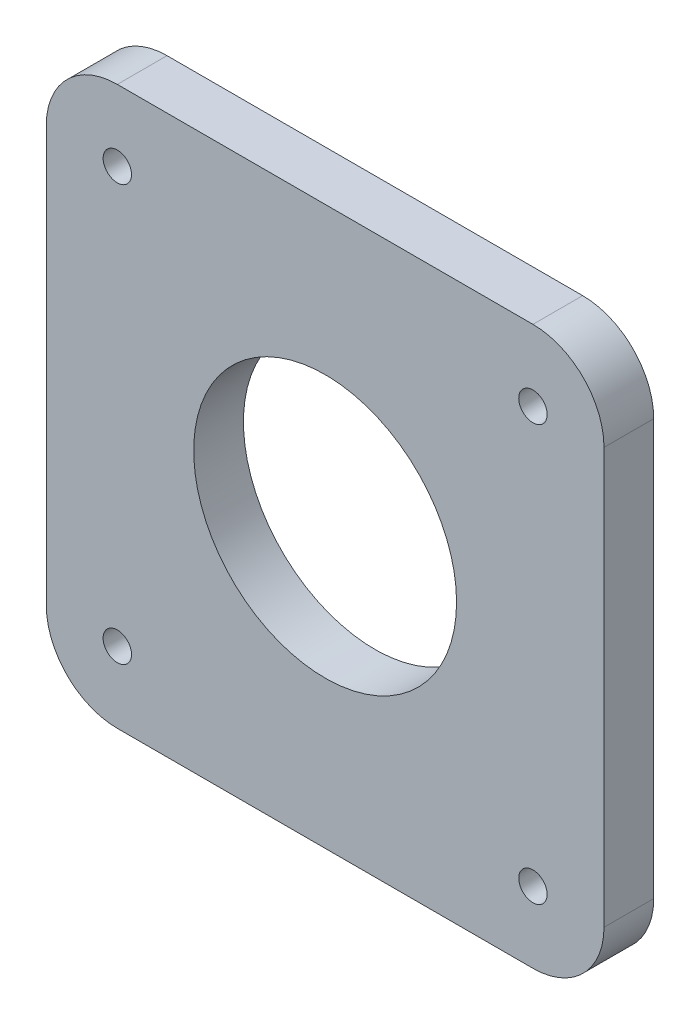
from build123d import *

# Parameters (mm, degrees)
SKETCH1_W           = 78.5
SKETCH1_H           = 78.5
BOSS_EXTRUDE1_DEPTH = 3.5
FILLET1_R           = 10
SKETCH2_R           = 2
CUT_EXTRUDE1_DEPTH  = 56.947520052
SKETCH3_R           = 18.5
CUT_EXTRUDE2_DEPTH  = 56.947520052


with BuildPart() as part:
    # Sketch1 → Boss-Extrude1 (new, symmetric)
    with BuildSketch(Plane.XY):
        Rectangle(SKETCH1_W, SKETCH1_H)
    extrude(amount=BOSS_EXTRUDE1_DEPTH, both=True)

    # Fillet1
    fillet1_edges = [part.edges().sort_by_distance(p)[0] for p in [
        (39.25, -39.25, 0),
        (-39.25, -39.25, 0),
        (-39.25, 39.25, 0),
        (39.25, 39.25, 0),
    ]]
    fillet(fillet1_edges, radius=FILLET1_R)

    # Sketch2 → Cut-Extrude1 (cut, through all)
    with BuildSketch(Plane.XY.offset(3.5)):
        with Locations((-29.25, 29.25)):
            Circle(SKETCH2_R)
        with Locations(Location((-29.25, -29.25, 0), (0, 0, 180))):
            Circle(SKETCH2_R)
        with Locations(Location((29.25, 29.25, 0), (0, 0, 180))):
            Circle(SKETCH2_R)
        with Locations((29.25, -29.25)):
            Circle(SKETCH2_R)
    extrude(amount=-CUT_EXTRUDE1_DEPTH, mode=Mode.SUBTRACT)

    # Sketch3 → Cut-Extrude2 (cut, through all)
    with BuildSketch(Plane.XY.offset(3.5)):
        Circle(SKETCH3_R)
    extrude(amount=-CUT_EXTRUDE2_DEPTH, mode=Mode.SUBTRACT)


solid = part.part
